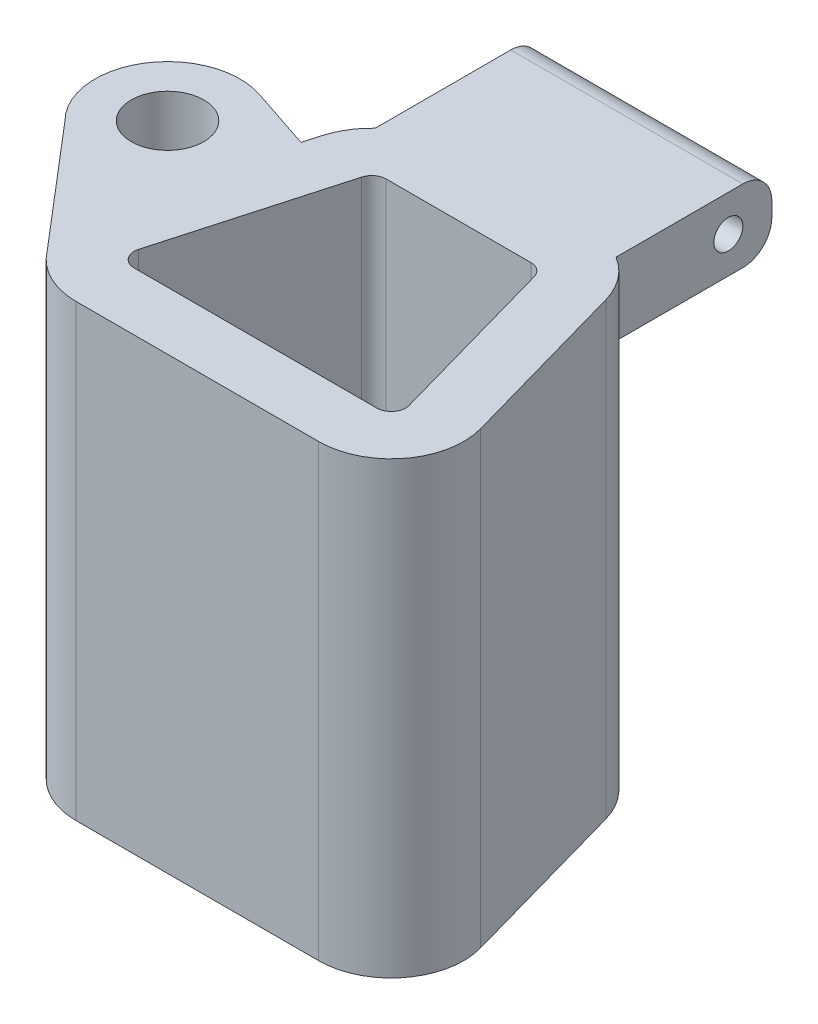
from build123d import *

# Parameters (mm, degrees)
BOSS_EXTRUDE1_DEPTH             = 31
SKETCH2_W                       = 16
SKETCH2_H                       = 5
BOSS_EXTRUDE2_DEPTH             = 10
BOSS_EXTRUDE2_DIRECTION_2_REACH = 42.293
SKETCH3_R                       = 1
CUT_EXTRUDE1_DEPTH              = 44.306250579
FILLET1_R                       = 2
SKETCH4_R                       = 2.5
BOSS_EXTRUDE3_DEPTH             = 31
SKETCH6_W                       = 18.969126519
SKETCH6_H                       = 17.5
CUT_EXTRUDE2_DEPTH              = 43.163504997


with BuildPart() as part:
    # Sketch1 → Boss-Extrude1 (new body)
    with BuildSketch(Plane(origin=(0, 0, 0), x_dir=(1, 0, 0), z_dir=(0, 1, 0))):
        with BuildLine():
            Line((-8.359903733, -11), (8.359903733, -11))
            ThreePointArc((8.359903733, -11), (12.345417465, -9.01921849), (13.173158433, -4.646272115))
            Line((13.173158433, -4.646272115), (9.798158433, 7.353727885))
            ThreePointArc((9.798158433, 7.353727885), (8.004122222, 9.985513732), (4.984903733, 11))
            Line((4.984903733, 11), (-4.984903733, 11))
            ThreePointArc((-4.984903733, 11), (-8.004122222, 9.985513732), (-9.798158433, 7.353727885))
            Line((-9.798158433, 7.353727885), (-13.173158433, -4.646272115))
            ThreePointArc((-13.173158433, -4.646272115), (-12.345417465, -9.01921849), (-8.359903733, -11))
        make_face()
        with BuildLine():
            Line((5.947554673, 6.270745577), (9.322554673, -5.729254423))
            ThreePointArc((9.322554673, -5.729254423), (9.157006479, -6.603843698), (8.359903733, -7))
            Line((8.359903733, -7), (-8.359903733, -7))
            ThreePointArc((-8.359903733, -7), (-9.157006479, -6.603843698), (-9.322554673, -5.729254423))
            Line((-9.322554673, -5.729254423), (-5.947554673, 6.270745577))
            ThreePointArc((-5.947554673, 6.270745577), (-5.588747431, 6.797102746), (-4.984903733, 7))
            Line((-4.984903733, 7), (4.984903733, 7))
            ThreePointArc((4.984903733, 7), (5.588747431, 6.797102746), (5.947554673, 6.270745577))
        make_face(mode=Mode.SUBTRACT)
    extrude(amount=BOSS_EXTRUDE1_DEPTH)

    # Sketch2 → Boss-Extrude2 (add)
    with BuildSketch(Plane(origin=(0, 0, -11), x_dir=(-1, 0, 0), z_dir=(0, 0, -1))):
        with Locations((0.398573677, 28.5)):
            Rectangle(SKETCH2_W, SKETCH2_H)
    extrude(amount=BOSS_EXTRUDE2_DEPTH)

    # Boss-Extrude2 direction 2: up to this face of the body (flat: up to its plane)
    boss_extrude2_direction_2_end = Plane(part.part.faces().sort_by_distance((0, 15.5, -7))[0])
    # Sketch2 → Boss-Extrude2 direction 2 (add, up to the picked face)
    with BuildSketch(Plane(origin=(0, 0, -11), x_dir=(-1, 0, 0), z_dir=(0, 0, -1)), mode=Mode.PRIVATE) as boss_extrude2_direction_2_sk1:
        with Locations((0.398573677, 28.5)):
            Rectangle(SKETCH2_W, SKETCH2_H)
    boss_extrude2_direction_2_tool1 = split(extrude(boss_extrude2_direction_2_sk1.sketch, amount=-BOSS_EXTRUDE2_DIRECTION_2_REACH, mode=Mode.PRIVATE), bisect_by=boss_extrude2_direction_2_end, keep=Keep.BOTH, mode=Mode.PRIVATE)
    add(boss_extrude2_direction_2_tool1.solids().sort_by(Axis((-0.398574, 28.5, -11), (0, 0, 1)))[0])

    # Sketch3 → Cut-Extrude1 (cut, through all)
    with BuildSketch(Plane.ZY.offset(8.398573677)):
        with Locations((-18, 28.5)):
            Circle(SKETCH3_R)
    extrude(amount=-CUT_EXTRUDE1_DEPTH, mode=Mode.SUBTRACT)

    # Fillet1
    fillet1_edges = [part.edges().sort_by_distance(p)[0] for p in [
        (-0.398573677, 31, -21),
        (-0.398573677, 26, -21),
    ]]
    fillet(fillet1_edges, radius=FILLET1_R)

    # Sketch4 → Boss-Extrude3 (add, through all)
    with BuildSketch(Plane(origin=(0, 31, 0), x_dir=(1, 0, 0), z_dir=(0, 1, 0))):
        with BuildLine():
            Line((-19.535533906, -0.596593374), (-12.345417465, -9.01921849))
            Line((-12.345417465, -9.01921849), (-10.109189958, 6.247838019))
            Line((-10.109189958, 6.247838019), (-14.420879995, 7.683029487))
            ThreePointArc((-14.420879995, 7.683029487), (-20.253813291, 5.566690993), (-19.535533906, -0.596593374))
        make_face()
        with Locations(Location((-16, 2.938940532, 0), (0, 0, 270))):
            Circle(SKETCH4_R, mode=Mode.SUBTRACT)
    extrude(amount=-BOSS_EXTRUDE3_DEPTH)

    # Sketch6 → Cut-Extrude2 (cut, through all)
    with BuildSketch(Plane(origin=(0.863884459, 0, -2.595334559), x_dir=(-0.9488177909602633, 0, -0.31582400092026913), z_dir=(0.31582400092026913, 0, -0.9488177909602633))):
        with Locations((21.109272612, 15.5)):
            Rectangle(SKETCH6_W, SKETCH6_H)
    extrude(amount=-CUT_EXTRUDE2_DEPTH, mode=Mode.SUBTRACT)


solid = part.part
